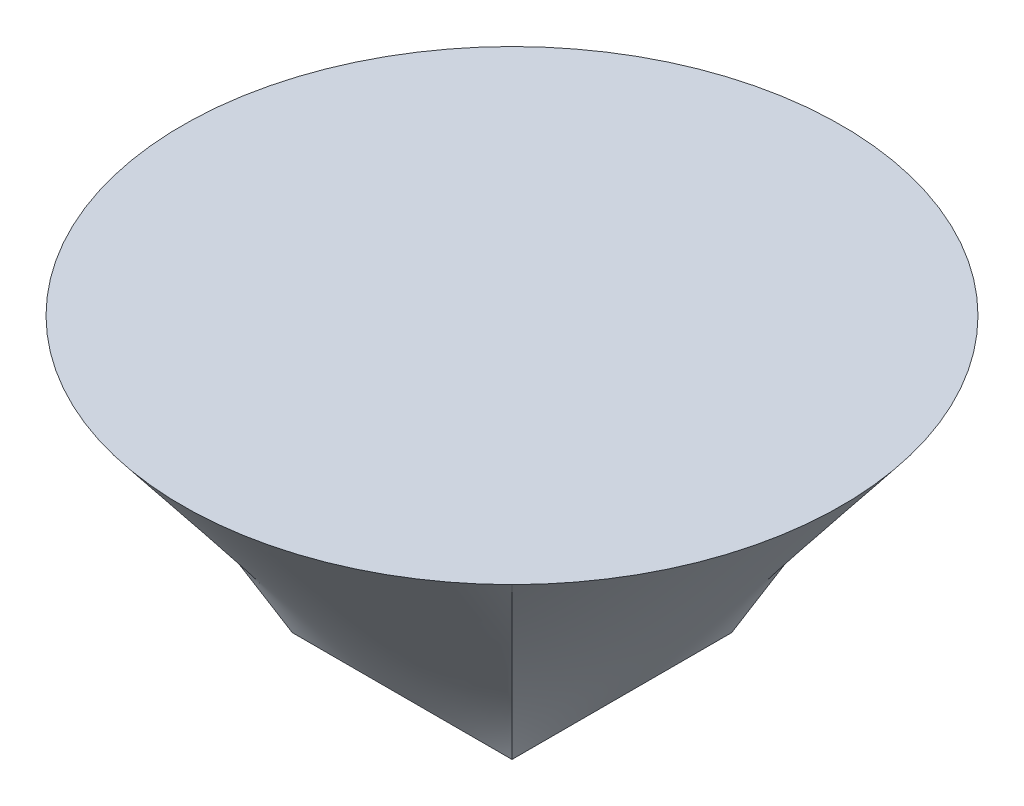
from build123d import *


with BuildPart() as part:
    # Esboço1 → Loft4 section 0
    with BuildSketch(Plane(origin=(0, 0, 0), x_dir=(1, 0, 0), z_dir=(0, 1, 0))):
        with BuildLine():
            Line((-20, -20), (20, -20))
            Line((20, -20), (20, 20))
            Line((20, 20), (-20, 20))
            Line((-20, 20), (-20, -20))
        make_face()
    # Esboço3 for Loft4 → Loft4 section 1
    with BuildSketch(Plane(origin=(0, 50, 0), x_dir=(1, 0, 0), z_dir=(0, 1, 0))):
        with BuildLine():
            # circular arc as an exact rational Bezier (weights 1, cos(half-angle), 1)
            Bezier((-42.426406871, -42.426406871), (0, -84.852813743), (42.426406871, -42.426406871), weights=[1, 0.707106781, 1])
            Bezier((42.426406871, -42.426406871), (84.852813743, 0), (42.426406871, 42.426406871), weights=[1, 0.707106781, 1])
            Bezier((42.426406871, 42.426406871), (0, 84.852813743), (-42.426406871, 42.426406871), weights=[1, 0.707106781, 1])
            Bezier((-42.426406871, 42.426406871), (-84.852813743, 0), (-42.426406871, -42.426406871), weights=[1, 0.707106781, 1])
        make_face()
    loft()


solid = part.part
